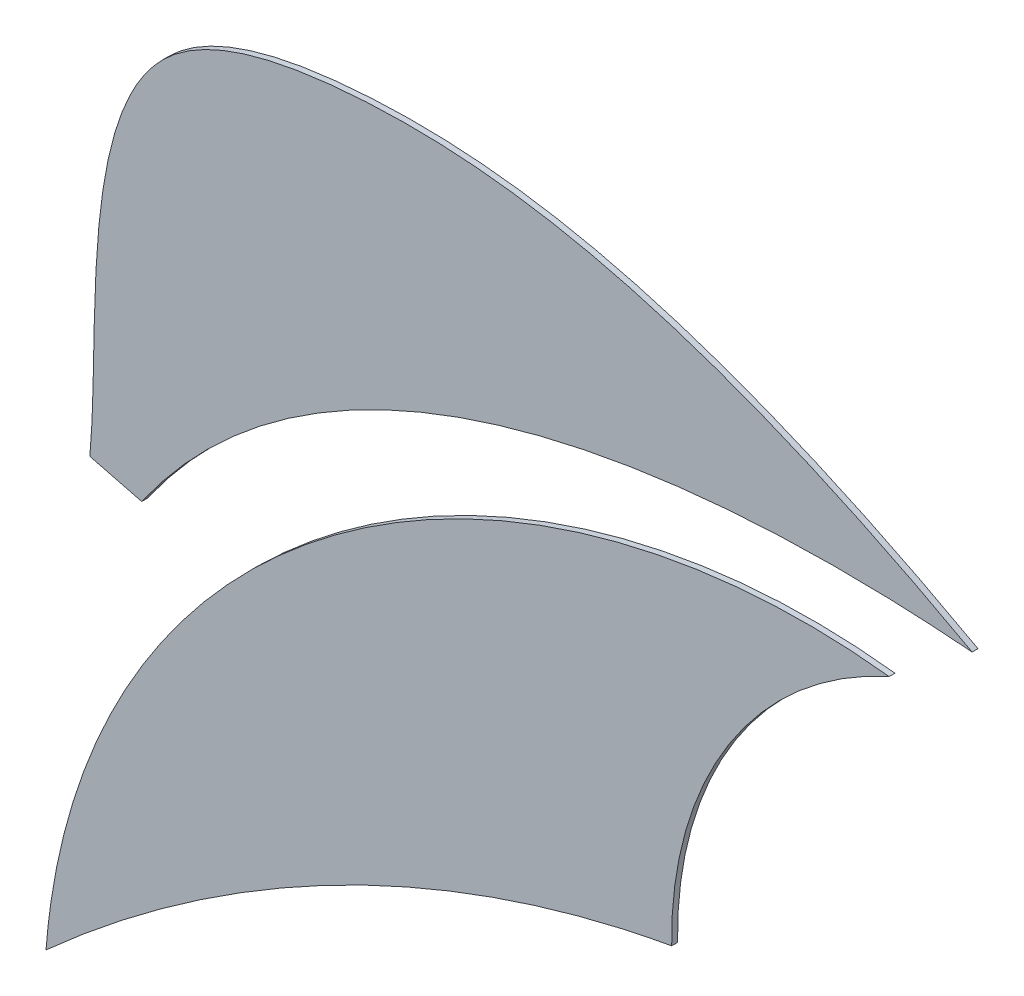
from build123d import *

# Parameters (mm, degrees)
EXTRUDE_1_DEPTH   = 0.6
EXTRUDE_1_2_DEPTH = 0.6


with BuildPart() as part:
    # 草图1 → 凸台-拉伸1 (new body)
    with BuildSketch(Plane.XY):
        with BuildLine():
            Line((16.15512727, 56.846859008), (21.452955127, 55.503747721))
            add(Edge.make_bspline(
                [(21.452955127, 55.503747721), (40.149818623, 82.212281294), (76.38662472, 87.049295069), (106.262087238, 84.5949857)],
                knots=[0, 0, 0, 0, 1, 1, 1, 1], degree=3))
            add(Edge.make_bspline(
                [(106.262087238, 84.5949857), (94.642059919, 90.975800839), (73.77398567, 100.524100711), (45.73254736, 103.606241894), (13.617789334, 97.326121883), (17.25272253, 67.877391354), (16.15512727, 56.846859008)],
                knots=[0, 0, 0, 0, 0.317400285, 0.524814147, 0.681364649, 1, 1, 1, 1], degree=3))
        make_face()
    extrude(amount=EXTRUDE_1_DEPTH)


with BuildPart() as body_2:
    # 草图1 → Extrude 1 2 (new body)
    with BuildSketch(Plane.XY):
        with BuildLine():
            ThreePointArc((97.78644664, 78.187405023), (81.447664837, 64.057114443), (75.57901186, 43.268179529))
            add(Edge.make_bspline(
                [(11.678089645, 10.957223348), (29.603758399, 27.075491347), (51.702494837, 38.987024657), (75.57901186, 43.268179529)],
                knots=[0, 0, 0, 0, 1, 1, 1, 1], degree=3))
            add(Edge.make_bspline(
                [(97.78644664, 78.187405023), (57.690236829, 82.868725074), (14.984988135, 53.345872874), (11.678089645, 10.957223348)],
                knots=[0, 0, 0, 0, 1, 1, 1, 1], degree=3))
        make_face()
    extrude(amount=EXTRUDE_1_2_DEPTH)


solid = Compound([part.part, body_2.part])
